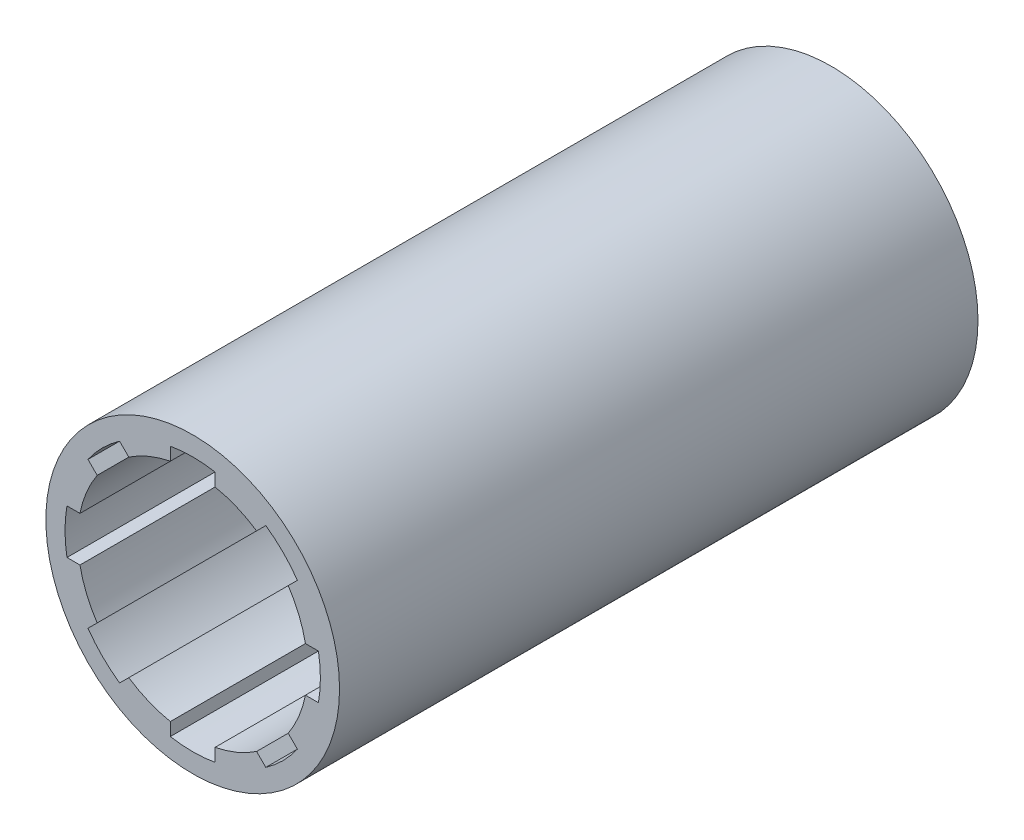
from build123d import *

# Parameters (mm, degrees)
SKETCH_1_R      = 23
SKETCH_1_R_2    = 20
EXTRUDE_1_DEPTH = 100
EXTRUDE_START   = -100
EXTRUDE_2_DEPTH = 100


with BuildPart() as part:
    # 草图1 → 凸台-拉伸1 (new body)
    with BuildSketch(Plane.XY):
        Circle(SKETCH_1_R)
        Circle(SKETCH_1_R_2, mode=Mode.SUBTRACT)
    extrude(amount=EXTRUDE_1_DEPTH)

    # 草图2 → 凸台-拉伸2 (add)
    with BuildSketch(Plane.XY.offset(100).offset(EXTRUDE_START)):
        with BuildLine():
            Line((-14.959864723, 10.010117255), (-16.39877405, 11.449026581))
            ThreePointArc((-16.39877405, 11.449026581), (-18.47759065, 7.653668647), (-19.691368668, 3.5))
            Line((-19.691368668, 3.5), (-17.656443583, 3.5))
            ThreePointArc((-17.656443583, 3.5), (-16.629831585, 6.888301783), (-14.959864723, 10.010117255))
        make_face()
        with BuildLine():
            Line((-3.5, 17.656443583), (-3.5, 19.691368668))
            ThreePointArc((-3.5, 19.691368668), (-7.653668647, 18.47759065), (-11.449026581, 16.39877405))
            Line((-11.449026581, 16.39877405), (-10.010117255, 14.959864723))
            ThreePointArc((-10.010117255, 14.959864723), (-6.888301783, 16.629831585), (-3.5, 17.656443583))
        make_face()
        with BuildLine():
            Line((10.010117255, 14.959864723), (11.449026581, 16.39877405))
            ThreePointArc((11.449026581, 16.39877405), (7.653668647, 18.47759065), (3.5, 19.691368668))
            Line((3.5, 19.691368668), (3.5, 17.656443583))
            ThreePointArc((3.5, 17.656443583), (6.888301783, 16.629831585), (10.010117255, 14.959864723))
        make_face()
        with BuildLine():
            ThreePointArc((19.691368668, 3.5), (18.47759065, 7.653668647), (16.39877405, 11.449026581))
            Line((16.39877405, 11.449026581), (14.959864723, 10.010117255))
            ThreePointArc((14.959864723, 10.010117255), (16.629831585, 6.888301783), (17.656443583, 3.5))
            Line((17.656443583, 3.5), (19.691368668, 3.5))
        make_face()
        with BuildLine():
            ThreePointArc((16.39877405, -11.449026581), (18.47759065, -7.653668647), (19.691368668, -3.5))
            Line((19.691368668, -3.5), (17.656443583, -3.5))
            ThreePointArc((17.656443583, -3.5), (16.629831585, -6.888301783), (14.959864723, -10.010117255))
            Line((14.959864723, -10.010117255), (16.39877405, -11.449026581))
        make_face()
        with BuildLine():
            ThreePointArc((3.5, -19.691368668), (7.653668647, -18.47759065), (11.449026581, -16.39877405))
            Line((11.449026581, -16.39877405), (10.010117255, -14.959864723))
            ThreePointArc((10.010117255, -14.959864723), (6.888301783, -16.629831585), (3.5, -17.656443583))
            Line((3.5, -17.656443583), (3.5, -19.691368668))
        make_face()
        with BuildLine():
            Line((-10.010117255, -14.959864723), (-11.449026581, -16.39877405))
            ThreePointArc((-11.449026581, -16.39877405), (-7.653668647, -18.47759065), (-3.5, -19.691368668))
            Line((-3.5, -19.691368668), (-3.5, -17.656443583))
            ThreePointArc((-3.5, -17.656443583), (-6.888301783, -16.629831585), (-10.010117255, -14.959864723))
        make_face()
        with BuildLine():
            Line((-17.656443583, -3.5), (-19.691368668, -3.5))
            ThreePointArc((-19.691368668, -3.5), (-18.47759065, -7.653668647), (-16.39877405, -11.449026581))
            Line((-16.39877405, -11.449026581), (-14.959864723, -10.010117255))
            ThreePointArc((-14.959864723, -10.010117255), (-16.629831585, -6.888301783), (-17.656443583, -3.5))
        make_face()
    extrude(amount=EXTRUDE_2_DEPTH)


solid = part.part
